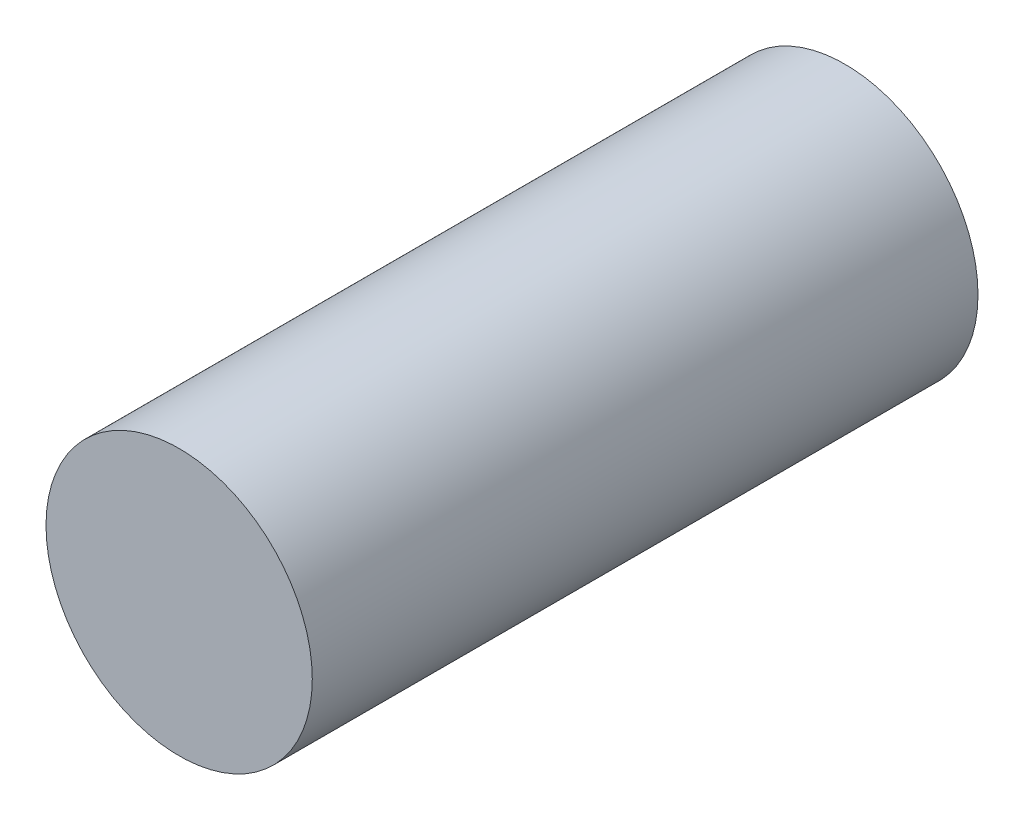
from build123d import *

# Parameters (mm, degrees)
SKETCH2_R           = 2
SKETCH2_R_2         = 1.5
BOSS_EXTRUDE1_DEPTH = 10
SKETCH2_2_R         = 2
BOSS_EXTRUDE2_DEPTH = 2


with BuildPart() as part:
    # Sketch2 → Boss-Extrude1 (new body)
    with BuildSketch(Plane.XY):
        Circle(SKETCH2_R)
        Circle(SKETCH2_R_2, mode=Mode.SUBTRACT)
    extrude(amount=-BOSS_EXTRUDE1_DEPTH)

    # Sketch2<2> → Boss-Extrude2 (add)
    with BuildSketch(Plane.XY):
        Circle(SKETCH2_2_R)
    extrude(amount=-BOSS_EXTRUDE2_DEPTH)


solid = part.part
